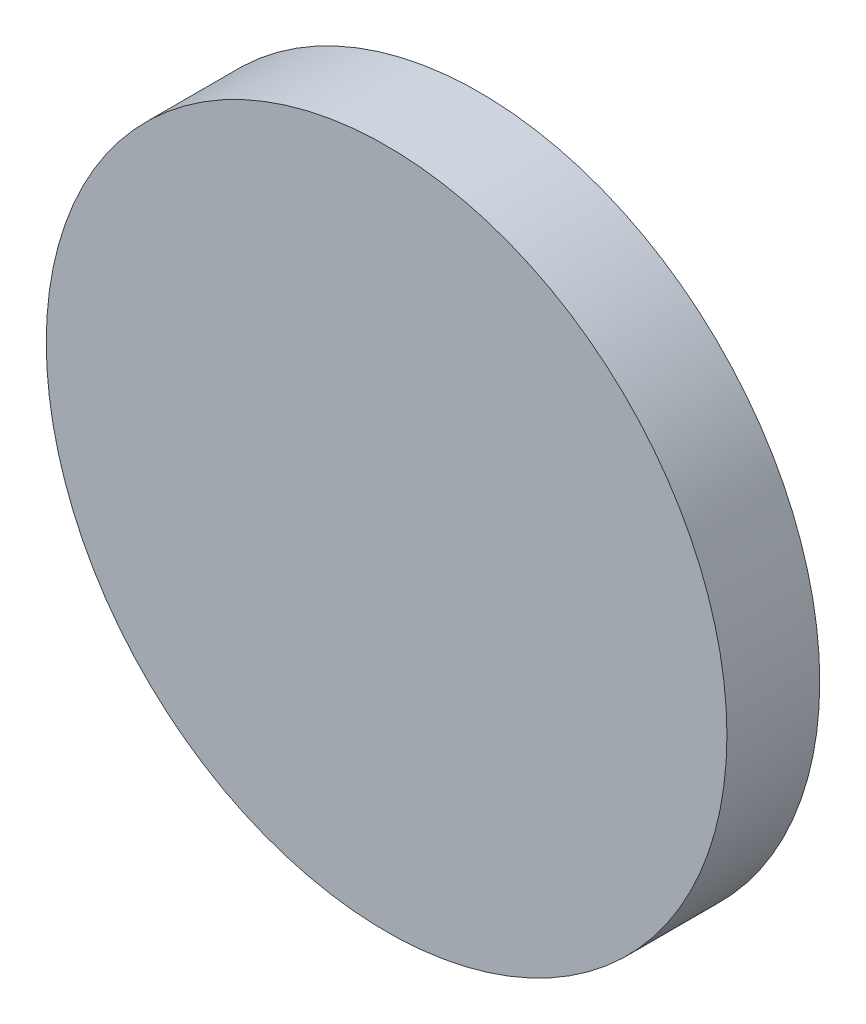
from build123d import *

# Parameters (mm, degrees)
SKETCH_1_R      = 11
EXTRUDE_4_DEPTH = 3


with BuildPart() as part:
    # Эскиз1 → Бобышка-Вытянуть4 (new body)
    with BuildSketch(Plane.XY):
        with Locations(Location((0, 0, 0), (0, 0, 180))):
            Circle(SKETCH_1_R)
    extrude(amount=EXTRUDE_4_DEPTH)


solid = part.part
